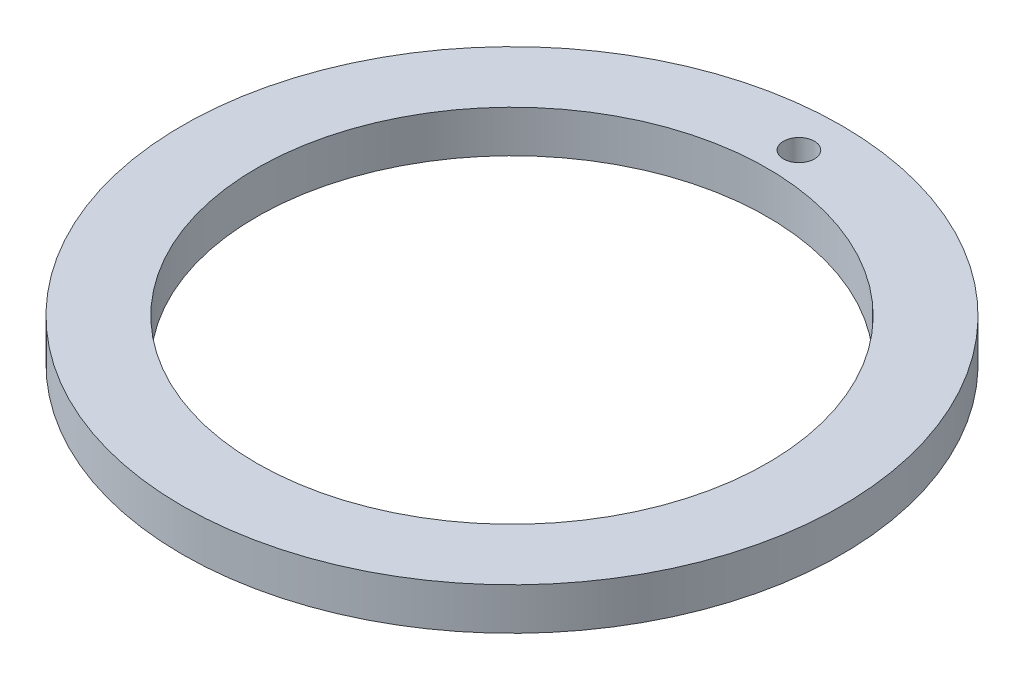
from build123d import *

# Parameters (mm, degrees)
SKETCH1_R           = 50.8
SKETCH1_R_2         = 39.37
SKETCH1_R_3         = 2.38125
BOSS_EXTRUDE1_DEPTH = 6.477


with BuildPart() as part:
    # Sketch1 → Boss-Extrude1 (new body)
    with BuildSketch(Plane(origin=(0, 0, 0), x_dir=(1, 0, 0), z_dir=(0, 1, 0))):
        with Locations(Location((0, 0, 0), (0, 0, 270))):
            Circle(SKETCH1_R)
        with Locations(Location((0, 0, 0), (0, 0, 270))):
            Circle(SKETCH1_R_2, mode=Mode.SUBTRACT)
        with Locations(Location((0, 44.22775, 0), (0, 0, 270))):
            Circle(SKETCH1_R_3, mode=Mode.SUBTRACT)
    extrude(amount=BOSS_EXTRUDE1_DEPTH)


solid = part.part
